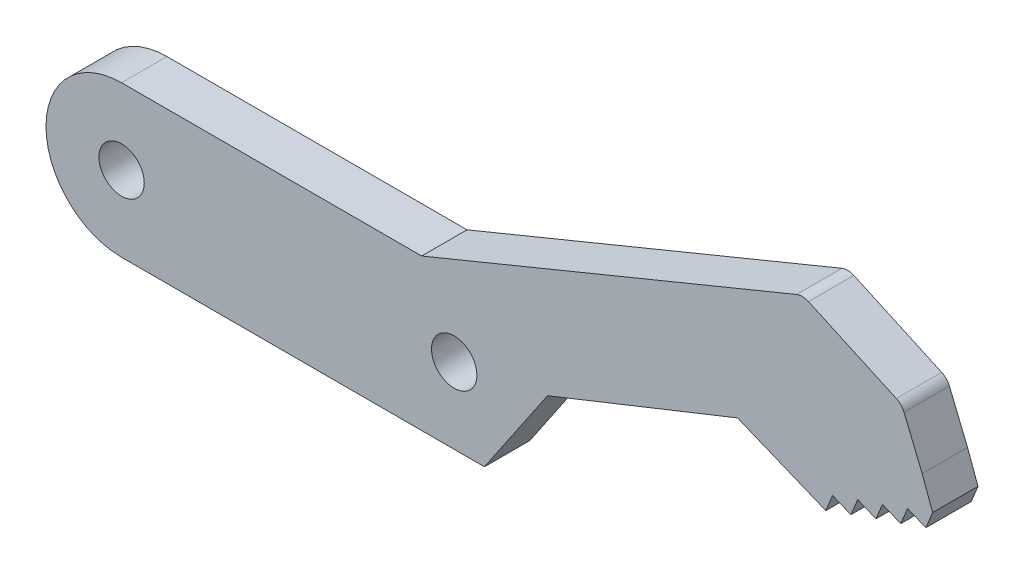
from build123d import *

# Parameters (mm, degrees)
SKETCH1_R           = 1.5
BOSS_EXTRUDE1_DEPTH = 3


with BuildPart() as part:
    # Sketch1 → Boss-Extrude1 (new body)
    with BuildSketch(Plane.XY):
        with BuildLine():
            Line((0, 5), (19.85, 5))
            Line((19.85, 5), (44.643069029, 15.193663072))
            ThreePointArc((44.643069029, 15.193663072), (45.042006379, 15.268610471), (45.43786686, 15.178818479))
            Line((45.43786686, 15.178818479), (51.245085043, 12.533540635))
            ThreePointArc((51.245085043, 12.533540635), (51.550738574, 12.317286013), (51.755428853, 12.003770413))
            Line((51.755428853, 12.003770413), (52.954960556, 9.086264498))
            Line((52.954960556, 9.086264498), (53.647413738, 7.201821951))
            Line((53.647413738, 7.201821951), (53.200417763, 6.109762155))
            Line((53.200417763, 6.109762155), (51.987413738, 6.606262365))
            Line((51.987413738, 6.606262365), (51.540417763, 5.514202569))
            Line((51.540417763, 5.514202569), (50.327413738, 6.010702778))
            Line((50.327413738, 6.010702778), (49.901790908, 4.970859901))
            Line((49.901790908, 4.970859901), (48.688786884, 5.467360111))
            Line((48.688786884, 5.467360111), (48.241790908, 4.375300315))
            Line((48.241790908, 4.375300315), (47.028786884, 4.871800524))
            Line((47.028786884, 4.871800524), (46.581790908, 3.779740729))
            Line((46.581790908, 3.779740729), (40.742047423, 6.170032768))
            Line((40.742047423, 6.170032768), (28.174379319, 1.158584034))
            Line((28.174379319, 1.158584034), (24, -5))
            Line((24, -5), (22, -5))
            Line((22, -5), (0, -5))
            ThreePointArc((0, -5), (-5, 0), (0, 5))
        make_face()
        Circle(SKETCH1_R, mode=Mode.SUBTRACT)
        with Locations((22, 0)):
            Circle(SKETCH1_R, mode=Mode.SUBTRACT)
    extrude(amount=BOSS_EXTRUDE1_DEPTH)


solid = part.part
